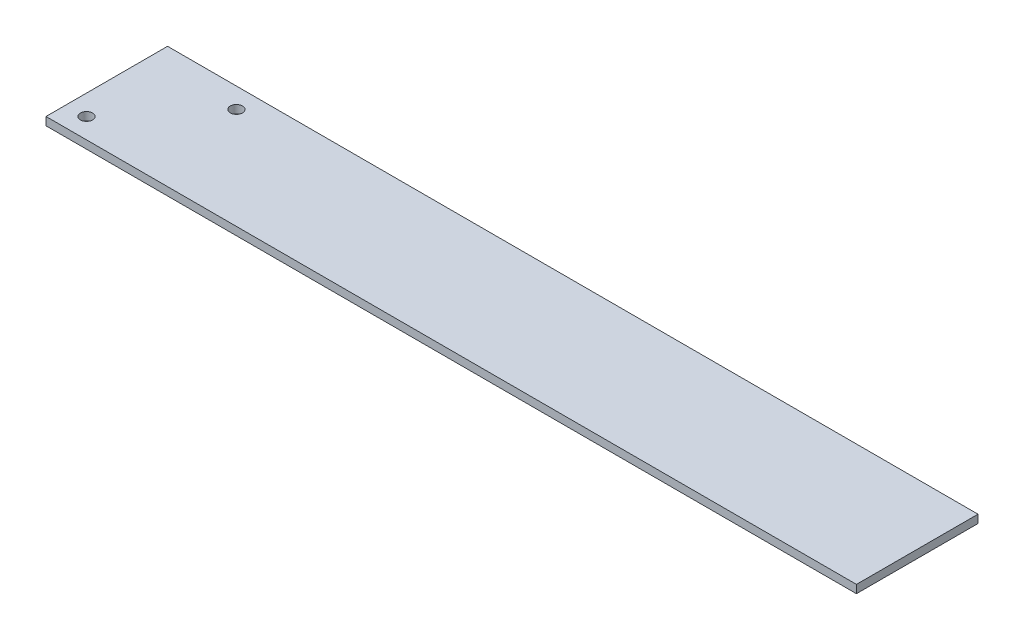
from build123d import *

# Parameters (mm, degrees)
SKETCH1_W           = 200
SKETCH1_H           = 30
SKETCH1_R           = 1.5
BOSS_EXTRUDE1_DEPTH = 2


with BuildPart() as part:
    # Sketch1 → Boss-Extrude1 (new body)
    with BuildSketch(Plane(origin=(0, 0, 0), x_dir=(1, 0, 0), z_dir=(0, 1, 0))):
        Rectangle(SKETCH1_W, SKETCH1_H)
        with Locations(Location((-95, -10, 0), (0, 0, 270))):
            Circle(SKETCH1_R, mode=Mode.SUBTRACT)
        with Locations(Location((-78, 10, 0), (0, 0, 270))):
            Circle(SKETCH1_R, mode=Mode.SUBTRACT)
    extrude(amount=BOSS_EXTRUDE1_DEPTH)


solid = part.part
